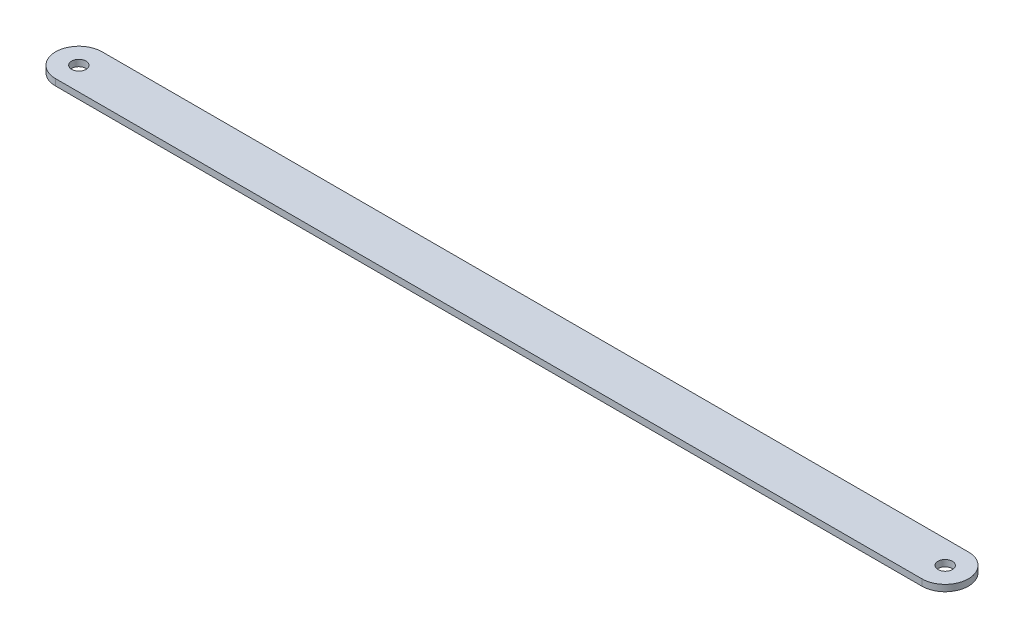
from build123d import *

# Parameters (mm, degrees)
SKETCH1_R           = 4.5
SKETCH1_R_2         = 6.5
SKETCH1_R_3         = 1.75
BOSS_EXTRUDE1_DEPTH = 4
SKETCH2_R           = 2
CUT_EXTRUDE1_DEPTH  = 4
SKETCH3_W           = 459.927601586
SKETCH3_H           = 370.798064125
CUT_EXTRUDE2_DEPTH  = 10


with BuildPart() as part:
    # Sketch1 → Boss-Extrude1 (new body)
    with BuildSketch(Plane(origin=(0, 0, 0), x_dir=(1, 0, 0), z_dir=(0, 1, 0))):
        with BuildLine():
            Line((-270, -14.5), (0, -14.5))
            Line((0, -14.5), (0, 340))
            Line((0, 340), (-175.463800793, 340))
            ThreePointArc((-175.463800793, 340), (-185.71684912, 335.753048327), (-189.963800793, 325.5))
            Line((-189.963800793, 325.5), (-189.963800793, 225.606590828))
            ThreePointArc((-189.963800793, 225.606590828), (-204.963800793, 210.606590828), (-189.963800793, 195.606590828))
            Line((-189.963800793, 195.606590828), (-189.963800793, 54.5))
            Line((-189.963800793, 54.5), (-229.963800793, 14.5))
            Line((-229.963800793, 14.5), (-270, 14.5))
            ThreePointArc((-270, 14.5), (-284.5, 0), (-270, -14.5))
        make_face()
        with Locations(Location((-270, 0, 0), (0, 0, 270))):
            Circle(SKETCH1_R, mode=Mode.SUBTRACT)
        with Locations(Location((-175.463800793, 325.5, 0), (0, 0, 270))):
            Circle(SKETCH1_R, mode=Mode.SUBTRACT)
        with Locations(Location((-189.963800793, 210.606590828, 0), (0, 0, 270))):
            Circle(SKETCH1_R_2, mode=Mode.SUBTRACT)
        with Locations(Location((-180.213800793, 210.606590828, 0), (0, 0, 270))):
            Circle(SKETCH1_R_3, mode=Mode.SUBTRACT)
        with Locations(Location((-189.963800793, 220.406590828, 0), (0, 0, 270))):
            Circle(SKETCH1_R_3, mode=Mode.SUBTRACT)
        with Locations(Location((-189.963800793, 200.806590828, 0), (0, 0, 270))):
            Circle(SKETCH1_R_3, mode=Mode.SUBTRACT)
        with Locations(Location((-199.713800793, 210.606590828, 0), (0, 0, 270))):
            Circle(SKETCH1_R_3, mode=Mode.SUBTRACT)
    boss_extrude1 = extrude(amount=BOSS_EXTRUDE1_DEPTH)

    # Mirror1: Boss-Extrude1 across plane
    add(boss_extrude1.mirror(Plane(origin=(0, 4, -340), x_dir=(0, 0, 1), z_dir=(-1, 0, 0))))

    # Sketch2 → Cut-Extrude1 (cut)
    with BuildSketch(Plane(origin=(0, 4, 0), x_dir=(1, 0, 0), z_dir=(0, 1, 0))):
        with Locations(Location((0, 305.5, 0), (0, 0, 270))):
            Circle(SKETCH2_R)
    extrude(amount=-CUT_EXTRUDE1_DEPTH, mode=Mode.SUBTRACT)

    # Sketch3 → Cut-Extrude2 (cut)
    with BuildSketch(Plane(origin=(0, 4, 0), x_dir=(1, 0, 0), z_dir=(0, 1, 0))):
        with Locations((0, 199.899032062)):
            Rectangle(SKETCH3_W, SKETCH3_H)
    extrude(amount=-CUT_EXTRUDE2_DEPTH, mode=Mode.SUBTRACT)


solid = part.part
